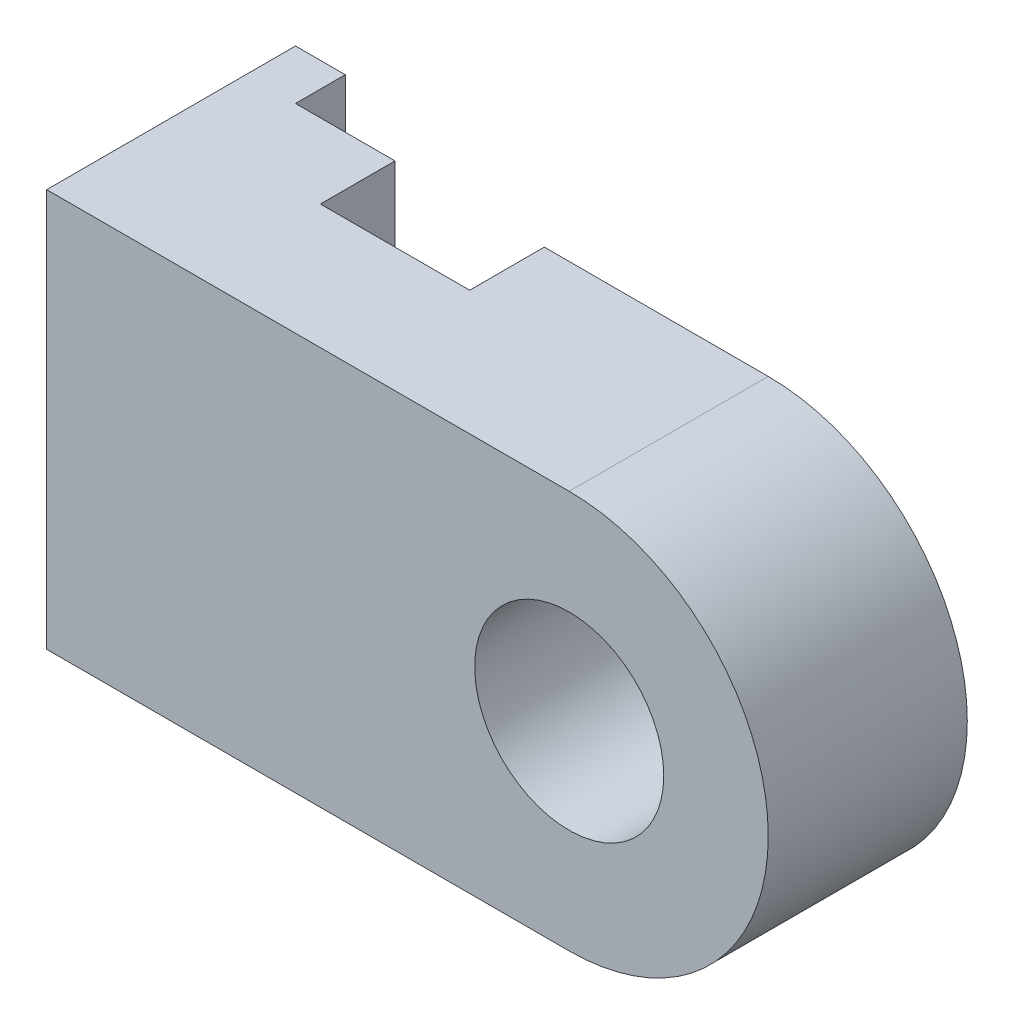
from build123d import *

# Parameters (mm, degrees)
SKETCH_1_R          = 1.9
EXTRUDE_1_DEPTH     = 4
SKETCH_2_W          = 3
SKETCH_2_H          = 1.5
CUT_EXTRUDE_1_DEPTH = 14.793114224
SKETCH_3_W          = 1
SKETCH_3_H          = 8
EXTRUDE_2_DEPTH     = 1


with BuildPart() as part:
    # 草图1 → 凸台-拉伸1 (new body)
    with BuildSketch(Plane.XY):
        with BuildLine():
            Line((0, 4), (-10.5, 4))
            Line((-10.5, 4), (-10.5, -4))
            Line((-10.5, -4), (0, -4))
            ThreePointArc((0, -4), (4, 0), (0, 4))
        make_face()
        Circle(SKETCH_1_R, mode=Mode.SUBTRACT)
    extrude(amount=EXTRUDE_1_DEPTH)

    # 草图2 → 切除-拉伸1 (cut, through all)
    with BuildSketch(Plane(origin=(0, 4, 0), x_dir=(1, 0, 0), z_dir=(0, 1, 0))):
        with Locations((-6, -0.75)):
            Rectangle(SKETCH_2_W, SKETCH_2_H)
    extrude(amount=-CUT_EXTRUDE_1_DEPTH, mode=Mode.SUBTRACT)

    # 草图3 → 凸台-拉伸2 (add)
    with BuildSketch(Plane(origin=(0, 0, 0), x_dir=(-1, 0, 0), z_dir=(0, 0, -1))):
        with Locations((10, 0)):
            Rectangle(SKETCH_3_W, SKETCH_3_H)
    extrude(amount=EXTRUDE_2_DEPTH)


solid = part.part
